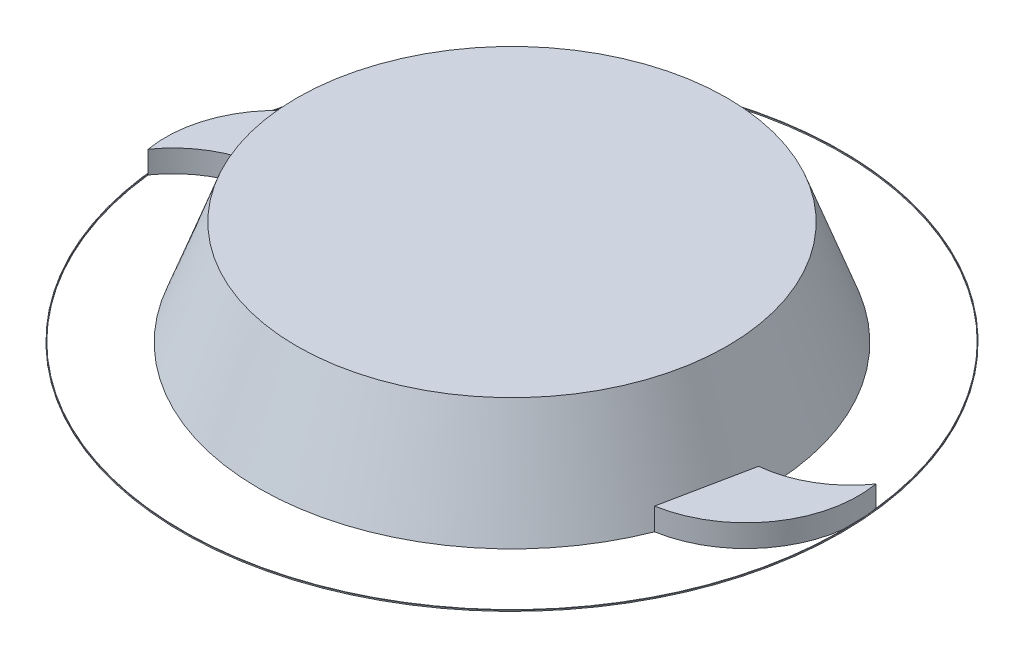
from build123d import *

# Parameters (mm, degrees)
SKETCH1_R           = 215.9
BOSS_EXTRUDE1_DEPTH = 88.9
BOSS_EXTRUDE1_TAPER = 20
BOSS_EXTRUDE2_DEPTH = 19.05
CIRPATTERN1_COUNT   = 2
SKETCH3_R           = 281.208754883
SKETCH3_R_2         = 280.708754883
EXTRUDE_THIN1_DEPTH = 1


with BuildPart() as part:
    # Sketch1 → Boss-Extrude1 (new body)
    with BuildSketch(Plane(origin=(0, 0, 0), x_dir=(1, 0, 0), z_dir=(0, 1, 0))):
        Circle(SKETCH1_R)
    extrude(amount=BOSS_EXTRUDE1_DEPTH, taper=BOSS_EXTRUDE1_TAPER)

    # Sketch2 → Boss-Extrude2 (add)
    with BuildSketch(Plane.XZ):
        with BuildLine():
            Line((-215.83125921, -5.447710344), (-200.854021104, -79.186313252))
            ThreePointArc((-200.854021104, -79.186313252), (-262.820614641, -40.008016754), (-278.934374009, 31.512220871))
            ThreePointArc((-278.934374009, 31.512220871), (-251.385968328, 6.197520074), (-215.83125921, -5.447710344))
        make_face()
    boss_extrude2 = extrude(amount=-BOSS_EXTRUDE2_DEPTH)

    # CirPattern1: Boss-Extrude2 ×2 about axis
    cirpattern1_axis = Axis((0, 0, 0), (0, 1, 0))
    for i in range(1, CIRPATTERN1_COUNT):
        add(boss_extrude2.rotate(cirpattern1_axis, i * 360 / CIRPATTERN1_COUNT))

    # Sketch3 → Extrude-Thin1 (add)
    with BuildSketch(Plane.XZ):
        Circle(SKETCH3_R)
        Circle(SKETCH3_R_2, mode=Mode.SUBTRACT)
    extrude(amount=-EXTRUDE_THIN1_DEPTH)


solid = part.part
